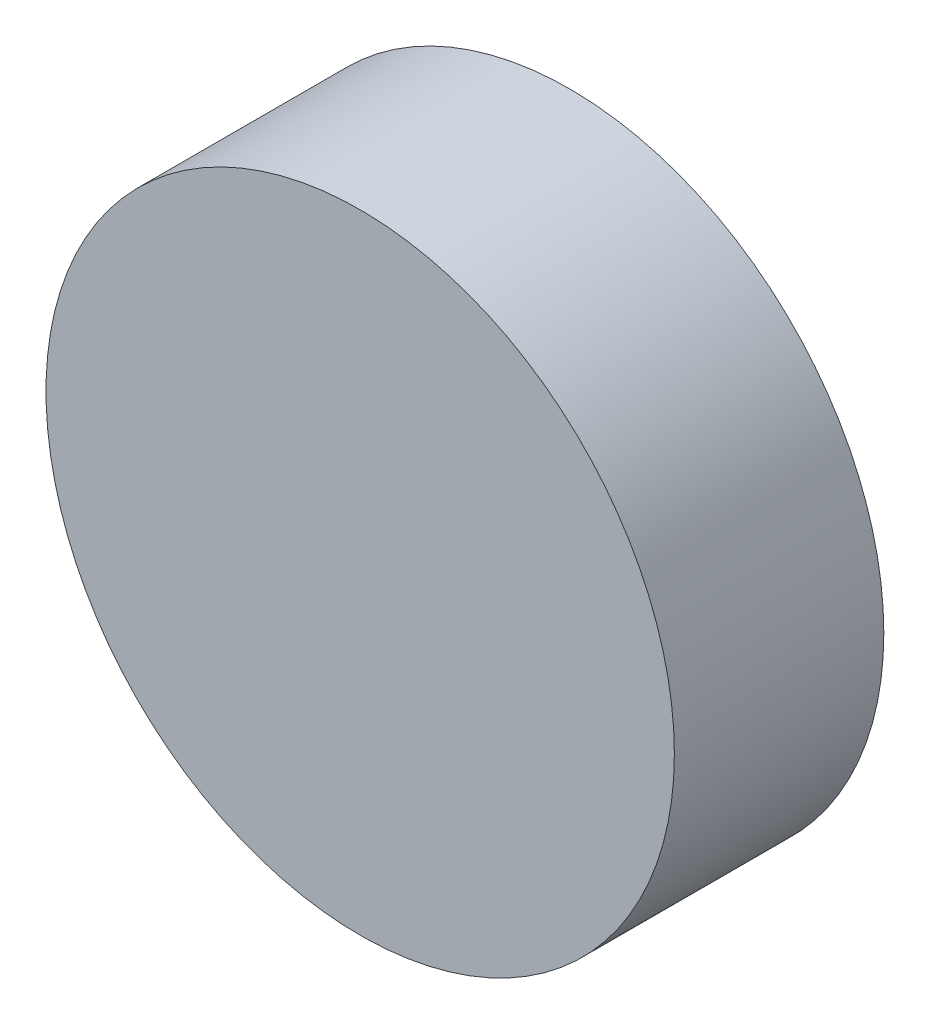
from build123d import *

# Parameters (mm, degrees)
SKETCH_1_R      = 1.5
EXTRUDE_1_DEPTH = 1


with BuildPart() as part:
    # ｽｹｯﾁ1 → ﾎﾞｽ - 押し出し1 (new body)
    with BuildSketch(Plane.XY):
        Circle(SKETCH_1_R)
    extrude(amount=EXTRUDE_1_DEPTH)


solid = part.part
